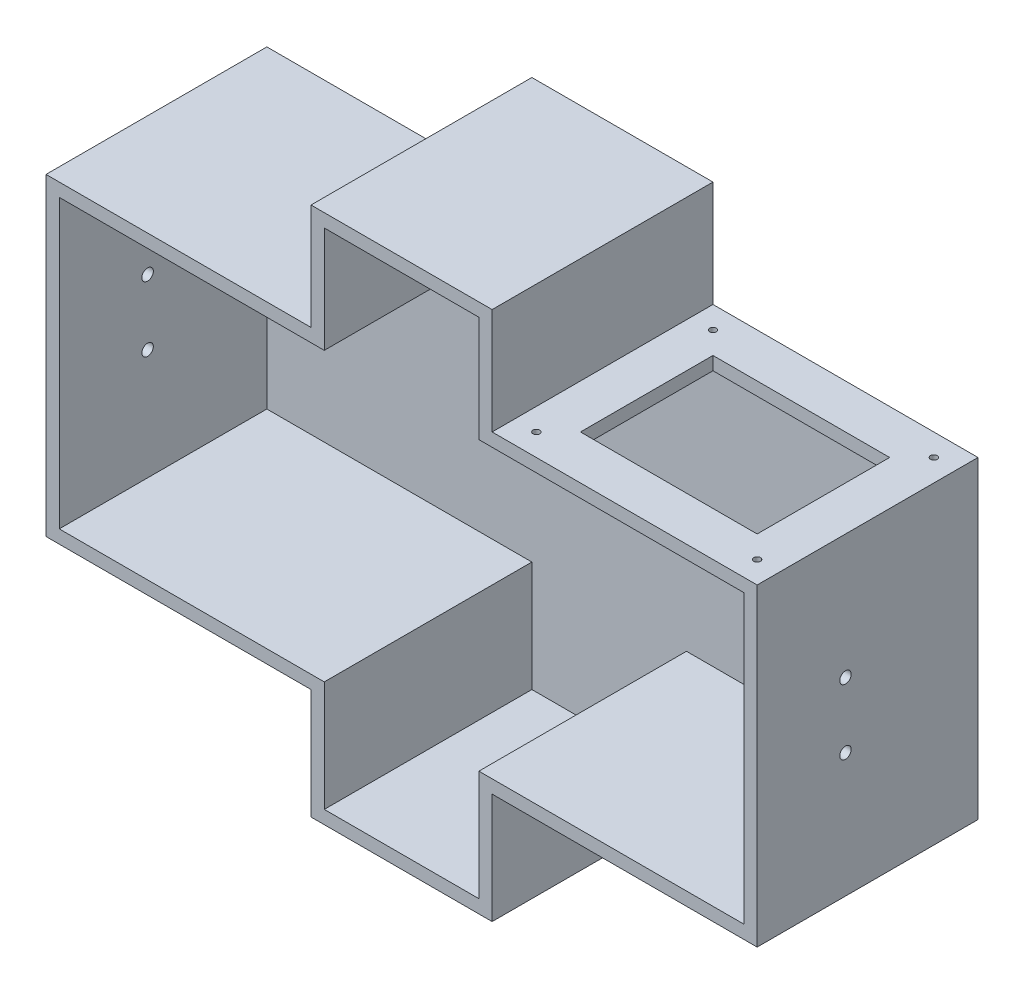
from build123d import *

# Parameters (mm, degrees)
SALIENTE_EXTRUIR1_DEPTH = 100
SALIENTE_EXTRUIR2_DEPTH = 6
CROQUIS4_R              = 1.5
CROQUIS4_W              = 80
CROQUIS4_H              = 60
CORTAR_EXTRUIR2_DEPTH   = 6
CROQUIS5_R              = 2.6
CORTAR_EXTRUIR3_DEPTH   = 358.888250715


with BuildPart() as part:
    # Croquis1 → Saliente-Extruir1 (new body)
    with BuildSketch(Plane.XY):
        Polygon((-41, 72), (-161, 72), (-161, -70), (-41, -70), (-41, -120), (41, -120), (41, -70), (161, -70), (161, 72), (41, 72), (41, 120), (-41, 120), align=None)
        Polygon((155, 66), (35, 66), (35, 114), (-35, 114), (-35, 66), (-155, 66), (-155, -64), (-35, -64), (-35, -114), (35, -114), (35, -64), (155, -64), align=None, mode=Mode.SUBTRACT)
    extrude(amount=SALIENTE_EXTRUIR1_DEPTH)

    # Croquis2 → Saliente-Extruir2 (add)
    with BuildSketch(Plane(origin=(0, 0, 0), x_dir=(-1, 0, 0), z_dir=(0, 0, -1))):
        Polygon((41, 72), (41, 120), (-41, 120), (-41, 72), (-161, 72), (-161, -70), (-41, -70), (-41, -120), (41, -120), (41, -70), (161, -70), (161, 72), align=None)
    extrude(amount=-SALIENTE_EXTRUIR2_DEPTH)

    # Croquis4 → Cortar-Extruir2 (cut)
    with BuildSketch(Plane(origin=(0, 72, 0), x_dir=(1, 0, 0), z_dir=(0, 1, 0))):
        with Locations(Location((151, -90, 0), (0, 0, 270))):
            Circle(CROQUIS4_R)
        with Locations(Location((51, -90, 0), (0, 0, 270))):
            Circle(CROQUIS4_R)
        with Locations(Location((51, -10, 0), (0, 0, 270))):
            Circle(CROQUIS4_R)
        with Locations(Location((151, -10, 0), (0, 0, 270))):
            Circle(CROQUIS4_R)
        with Locations((101, -50)):
            Rectangle(CROQUIS4_W, CROQUIS4_H)
    extrude(amount=-CORTAR_EXTRUIR2_DEPTH, mode=Mode.SUBTRACT)

    # Croquis5 → Cortar-Extruir3 (cut, through all)
    with BuildSketch(Plane(origin=(161, 0, 0), x_dir=(0, 0, -1), z_dir=(1, 0, 0))):
        with Locations((-60, -13.75)):
            Circle(CROQUIS5_R)
        with Locations((-60, 15.75)):
            Circle(CROQUIS5_R)
    extrude(amount=-CORTAR_EXTRUIR3_DEPTH, mode=Mode.SUBTRACT)


solid = part.part
